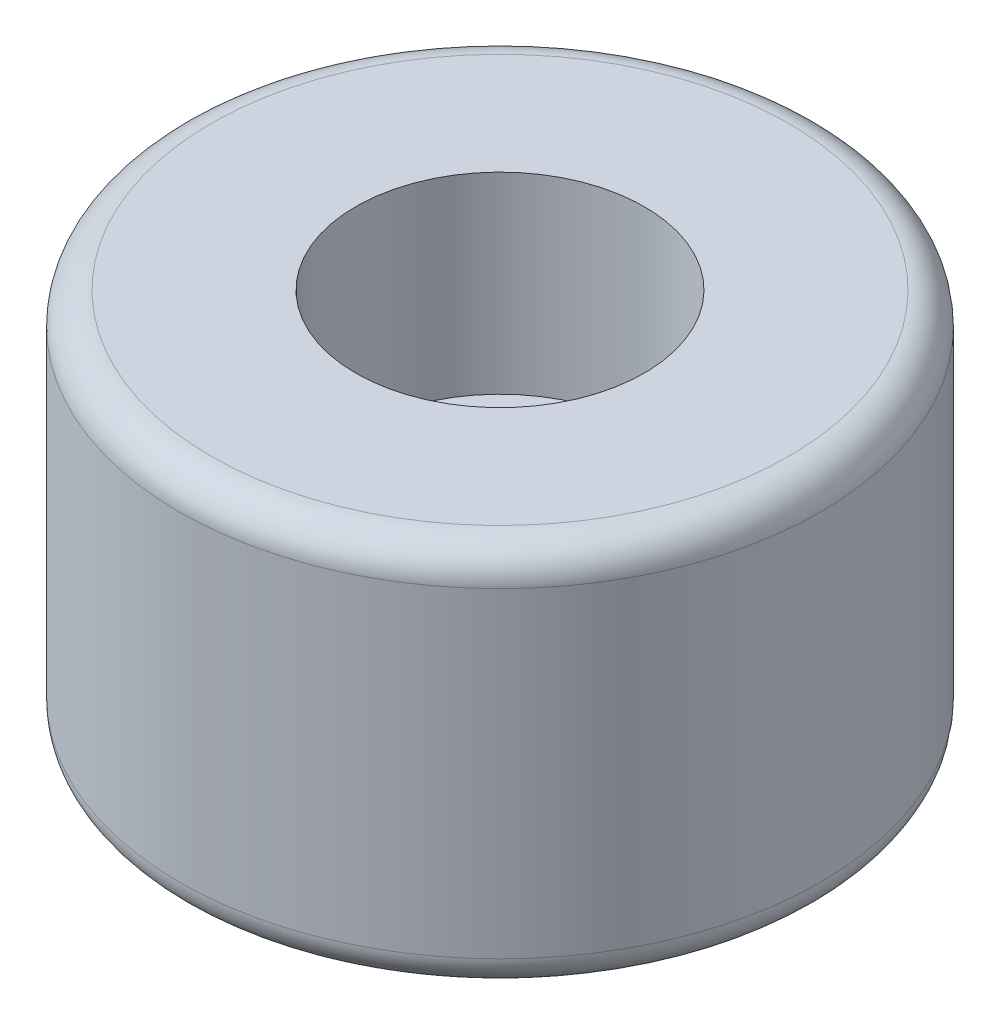
from build123d import *

# Parameters (mm, degrees)
SKETCH1_R           = 31.75
BOSS_EXTRUDE1_DEPTH = 38.1
FILLET1_R           = 3.175
SKETCH2_R           = 14.2875
CUT_EXTRUDE1_DEPTH  = 19.05
SKETCH3_R           = 4.7625
CUT_EXTRUDE2_DEPTH  = 3.175
SKETCH4_R           = 3.175
CUT_EXTRUDE3_DEPTH  = 51.100654936
CUT_EXTRUDE4_START  = -15.875
SKETCH5_R           = 14.2875
CUT_EXTRUDE4_DEPTH  = 15.875
SKETCH6_R           = 4.7625
BOSS_EXTRUDE2_DEPTH = 9.525
DRAFT2_ANGLE        = 3
SKETCH7_R           = 1.5875
CUT_EXTRUDE5_DEPTH  = 55.99261314


with BuildPart() as part:
    # Sketch1 → Boss-Extrude1 (new body)
    with BuildSketch(Plane(origin=(0, 0, 0), x_dir=(1, 0, 0), z_dir=(0, 1, 0))):
        with Locations(Location((0, 0, 0), (0, 0, 90))):
            Circle(SKETCH1_R)
    extrude(amount=BOSS_EXTRUDE1_DEPTH)

    # Fillet1
    fillet1_edges = [part.edges().sort_by_distance(p)[0] for p in [
        (0, 0, 31.75),
        (0, 38.1, 31.75),
    ]]
    fillet(fillet1_edges, radius=FILLET1_R)

    # Sketch2 → Cut-Extrude1 (cut)
    with BuildSketch(Plane(origin=(0, 38.1, 0), x_dir=(1, 0, 0), z_dir=(0, 1, 0))):
        with Locations(Location((0, 0, 0), (0, 0, 270))):
            Circle(SKETCH2_R)
    extrude(amount=-CUT_EXTRUDE1_DEPTH, mode=Mode.SUBTRACT)

    # Sketch3 → Cut-Extrude2 (cut)
    with BuildSketch(Plane(origin=(0, 19.05, 0), x_dir=(1, 0, 0), z_dir=(0, 1, 0))):
        with Locations(Location((0, 0, 0), (0, 0, 270))):
            Circle(SKETCH3_R)
    extrude(amount=-CUT_EXTRUDE2_DEPTH, mode=Mode.SUBTRACT)

    # Sketch4 → Cut-Extrude3 (cut, through all)
    with BuildSketch(Plane(origin=(0, 15.875, 0), x_dir=(1, 0, 0), z_dir=(0, 1, 0))):
        with Locations(Location((0, 0, 0), (0, 0, 270))):
            Circle(SKETCH4_R)
    extrude(amount=-CUT_EXTRUDE3_DEPTH, mode=Mode.SUBTRACT)

    # Sketch5 → Cut-Extrude4 (cut)
    with BuildSketch(Plane.XZ.offset(CUT_EXTRUDE4_START)):
        with Locations(Location((0, 0, 0), (0, 0, 90))):
            Circle(SKETCH5_R)
    extrude(amount=CUT_EXTRUDE4_DEPTH, mode=Mode.SUBTRACT)

    # Sketch6 → Boss-Extrude2 (add)
    with BuildSketch(Plane(origin=(0, 15.875, 0), x_dir=(-1, 0, 0), z_dir=(0, -1, 0))):
        with BuildLine():
            Line((-9.525, -1), (-6.270765504, -1))
            ThreePointArc((-6.270765504, -1), (-4.978895322, -3.941205573), (-2.412791109, -5.87375))
            ThreePointArc((-2.412791109, -5.87375), (0, -11.1125), (2.412791109, -5.87375))
            ThreePointArc((2.412791109, -5.87375), (4.978895322, -3.941205573), (6.270765504, -1))
            Line((6.270765504, -1), (9.525, -1))
            ThreePointArc((9.525, -1), (10.525, 0), (9.525, 1))
            Line((9.525, 1), (6.270765504, 1))
            ThreePointArc((6.270765504, 1), (4.978895322, 3.941205573), (2.412791109, 5.87375))
            ThreePointArc((2.412791109, 5.87375), (0, 11.1125), (-2.412791109, 5.87375))
            ThreePointArc((-2.412791109, 5.87375), (-4.978895322, 3.941205573), (-6.270765504, 1))
            Line((-6.270765504, 1), (-9.525, 1))
            ThreePointArc((-9.525, 1), (-10.525, 0), (-9.525, -1))
        make_face()
        with Locations(Location((0, 0, 0), (0, 0, 270))):
            Circle(SKETCH6_R, mode=Mode.SUBTRACT)
    extrude(amount=BOSS_EXTRUDE2_DEPTH)

    # Draft2
    draft2_faces = [part.faces().sort_by_distance(p)[0] for p in [
        (10.525, 11.1125, 0),
        (4.978895322, 11.1125, 3.941205573),
        (7.897882752, 11.1125, 1),
        (7.897882752, 11.1125, -1),
        (4.978895322, 11.1125, -3.941205573),
        (0, 11.1125, -11.1125),
        (-7.897882752, 11.1125, 1),
        (-7.897882752, 11.1125, -1),
        (-10.525, 11.1125, 0),
        (-4.978895322, 11.1125, -3.941205573),
        (-4.978895322, 11.1125, 3.941205573),
        (0, 11.1125, 11.1125),
    ]]
    draft(draft2_faces, Plane(origin=(0, 6.35, 0), x_dir=(0, 0, -1), z_dir=(0, -1, 0)), DRAFT2_ANGLE)

    # Sketch7 → Cut-Extrude5 (cut, through all)
    with BuildSketch(Plane(origin=(0, 6.35, 0), x_dir=(-1, 0, 0), z_dir=(0, -1, 0))):
        with Locations(Location((0, 7.9375, 0), (0, 0, 90))):
            Circle(SKETCH7_R)
        with Locations(Location((0, -7.9375, 0), (0, 0, 270))):
            Circle(SKETCH7_R)
    extrude(amount=-CUT_EXTRUDE5_DEPTH, mode=Mode.SUBTRACT)


solid = part.part
